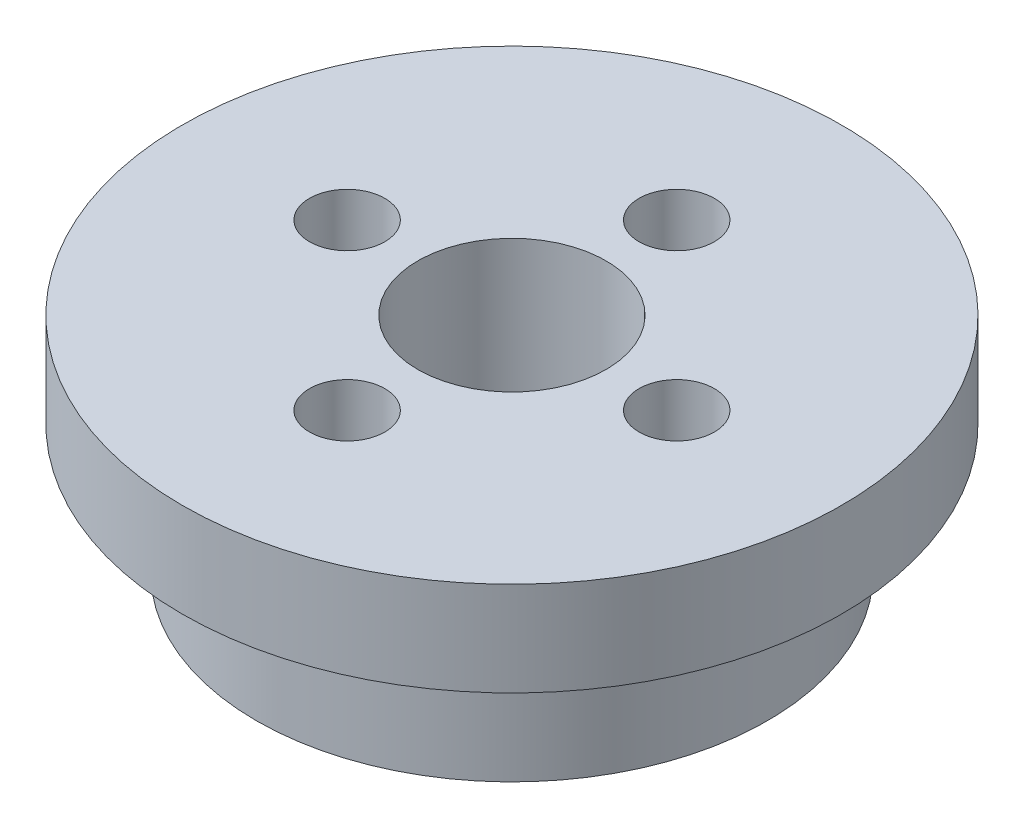
from build123d import *

# Parameters (mm, degrees)
SKETCH_3_R          = 10.85
EXTRUDE_1_DEPTH     = 5.5
SKETCH_4_R          = 14
EXTRUDE_2_DEPTH     = 4
SKETCH_5_R          = 4
SKETCH_5_R_2        = 1.6
CUT_EXTRUDE_1_DEPTH = 50


with BuildPart() as part:
    # 草图3 → 凸台-拉伸1 (new body)
    with BuildSketch(Plane(origin=(0, 0, 0), x_dir=(1, 0, 0), z_dir=(0, 1, 0))):
        with Locations(Location((0, 0, 0), (0, 0, 270))):
            Circle(SKETCH_3_R)
    extrude(amount=EXTRUDE_1_DEPTH)

    # 草图4 → 凸台-拉伸2 (add)
    with BuildSketch(Plane(origin=(0, 5.5, 0), x_dir=(1, 0, 0), z_dir=(0, 1, 0))):
        with Locations(Location((0, 0, 0), (0, 0, 270))):
            Circle(SKETCH_4_R)
    extrude(amount=EXTRUDE_2_DEPTH)

    # 草图5 → 切除-拉伸1 (cut)
    with BuildSketch(Plane(origin=(0, 9.5, 0), x_dir=(1, 0, 0), z_dir=(0, 1, 0))):
        with Locations(Location((0, 0, 0), (0, 0, 270))):
            Circle(SKETCH_5_R)
        with Locations(Location((0, 7, 0), (0, 0, 270))):
            Circle(SKETCH_5_R_2)
        with Locations(Location((7, 0, 0), (0, 0, 270))):
            Circle(SKETCH_5_R_2)
        with Locations(Location((0, -7, 0), (0, 0, 270))):
            Circle(SKETCH_5_R_2)
        with Locations(Location((-7, 0, 0), (0, 0, 270))):
            Circle(SKETCH_5_R_2)
    extrude(amount=-CUT_EXTRUDE_1_DEPTH, mode=Mode.SUBTRACT)


solid = part.part
